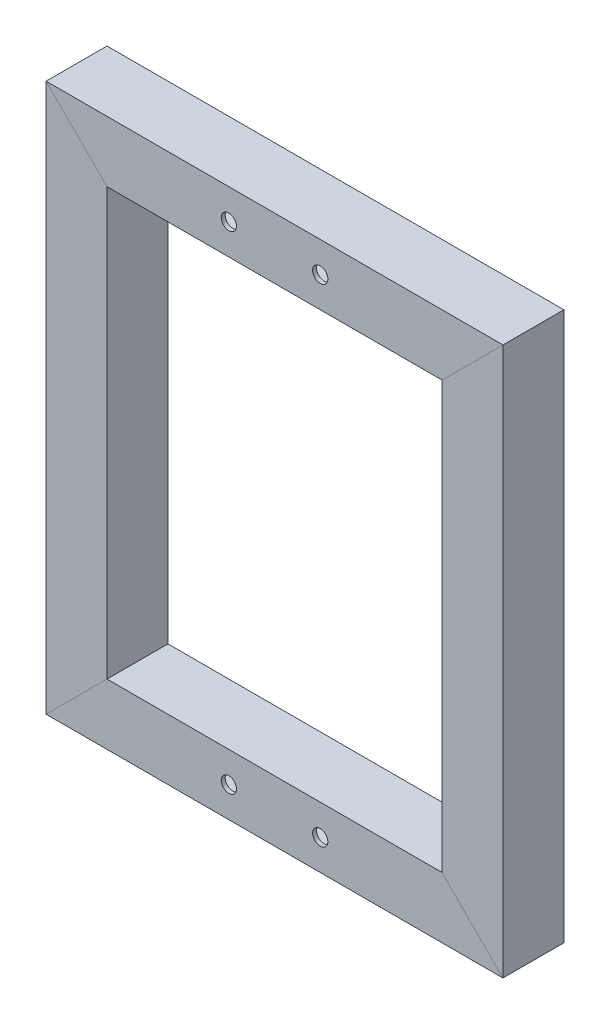
from build123d import *

# Parameters (mm, degrees)
STRUCTURAL_MEMBER1_DEPTH      = 227.421024484
STRUCTURAL_MEMBER1_DEPTH_BACK = 36.921024484
SKETCH11_W                    = 25.4
SKETCH11_H                    = 25.4
SKETCH11_W_2                  = 22.098
SKETCH11_H_2                  = 22.098
SKETCH11_ON_SEGMENT_2_W       = 25.4
SKETCH11_ON_SEGMENT_2_H       = 25.4
SKETCH11_ON_SEGMENT_2_W_2     = 22.098
SKETCH11_ON_SEGMENT_2_H_2     = 22.098
STRUCTURAL_MEMBER1_2_DEPTH    = 302.442048969
SKETCH11_ON_SEGMENT_3_W       = 25.4
SKETCH11_ON_SEGMENT_3_H       = 25.4
SKETCH11_ON_SEGMENT_3_W_2     = 22.098
SKETCH11_ON_SEGMENT_3_H_2     = 22.098
STRUCTURAL_MEMBER1_3_DEPTH    = 264.342048969
SKETCH11_ON_SEGMENT_4_W       = 25.4
SKETCH11_ON_SEGMENT_4_H       = 25.4
SKETCH11_ON_SEGMENT_4_W_2     = 22.098
SKETCH11_ON_SEGMENT_4_H_2     = 22.098
STRUCTURAL_MEMBER1_4_DEPTH    = 302.442048969
SKETCH13_R                    = 3.175
CUT_EXTRUDE1_DEPTH            = 262.797779946
SKETCH14_R                    = 3.175
CUT_EXTRUDE2_DEPTH            = 262.797779946


with BuildPart() as part:
    # Sketch11 → Structural Member1 (new, two sides: drawn at the far end of the back side and taken through both)
    with BuildSketch(Plane(origin=(-217.090748408, 131.399009505, 12.7), x_dir=(0, 1, 0), z_dir=(1, 0, 0)).offset(-STRUCTURAL_MEMBER1_DEPTH_BACK)):
        Rectangle(SKETCH11_W, SKETCH11_H)
        Rectangle(SKETCH11_W_2, SKETCH11_H_2, mode=Mode.SUBTRACT)
    extrude(amount=STRUCTURAL_MEMBER1_DEPTH + STRUCTURAL_MEMBER1_DEPTH_BACK)

    # Structural Member1 mitre 1
    split(bisect_by=Plane(origin=(-217.090748408, 144.099009505, 0), x_dir=(-0.707106781, 0.707106781, 0), z_dir=(0.707106781, 0.707106781, 0)), keep=Keep.TOP)

    # Structural Member1 mitre 2
    split(bisect_by=Plane(origin=(-26.590748408, 144.099009505, 0), x_dir=(-0.707106781, -0.707106781, 0), z_dir=(-0.707106781, 0.707106781, 0)), keep=Keep.TOP)

    # Sketch13 → Cut-Extrude1 (cut, through all)
    with BuildSketch(Plane(origin=(0, 0, 0), x_dir=(-1, 0, 0), z_dir=(0, 0, -1))):
        with Locations(Location((102.790748408, 131.399009505, 0), (0, 0, 90))):
            Circle(SKETCH13_R)
        with Locations(Location((140.890748408, 131.399009505, 0), (0, 0, 90))):
            Circle(SKETCH13_R)
    extrude(amount=-CUT_EXTRUDE1_DEPTH, mode=Mode.SUBTRACT)


with BuildPart() as body_2:
    # Sketch11 on segment 2 (carried to segment 2) → Structural Member1 2 (new body)
    with BuildSketch(Plane(origin=(-39.290748408, 181.020033989, 12.7), x_dir=(1, 0, 0), z_dir=(0, -1, 0))):
        Rectangle(SKETCH11_ON_SEGMENT_2_W, SKETCH11_ON_SEGMENT_2_H)
        Rectangle(SKETCH11_ON_SEGMENT_2_W_2, SKETCH11_ON_SEGMENT_2_H_2, mode=Mode.SUBTRACT)
    extrude(amount=STRUCTURAL_MEMBER1_2_DEPTH)

    # Structural Member1 2 mitre 1
    split(bisect_by=Plane(origin=(-26.590748408, 144.099009505, 0), x_dir=(0.707106781, 0.707106781, 0), z_dir=(0.707106781, -0.707106781, 0)), keep=Keep.TOP)

    # Structural Member1 2 mitre 2
    split(bisect_by=Plane(origin=(-26.590748408, -84.500990495, 0), x_dir=(-0.707106781, 0.707106781, 0), z_dir=(0.707106781, 0.707106781, 0)), keep=Keep.TOP)


with BuildPart() as body_3:
    # Sketch11 on segment 3 (carried to segment 3) → Structural Member1 3 (new body)
    with BuildSketch(Plane(origin=(10.330276076, -71.800990495, 12.7), x_dir=(0, -1, 0), z_dir=(-1, 0, 0))):
        Rectangle(SKETCH11_ON_SEGMENT_3_W, SKETCH11_ON_SEGMENT_3_H)
        Rectangle(SKETCH11_ON_SEGMENT_3_W_2, SKETCH11_ON_SEGMENT_3_H_2, mode=Mode.SUBTRACT)
    extrude(amount=STRUCTURAL_MEMBER1_3_DEPTH)

    # Structural Member1 3 mitre 1
    split(bisect_by=Plane(origin=(-217.090748408, -84.500990495, 0), x_dir=(0.707106781, 0.707106781, 0), z_dir=(0.707106781, -0.707106781, 0)), keep=Keep.TOP)

    # Structural Member1 3 mitre 2
    split(bisect_by=Plane(origin=(-26.590748408, -84.500990495, 0), x_dir=(0.707106781, -0.707106781, 0), z_dir=(-0.707106781, -0.707106781, 0)), keep=Keep.TOP)

    # Sketch14 → Cut-Extrude2 (cut, through all)
    with BuildSketch(Plane(origin=(0, 0, 0), x_dir=(-1, 0, 0), z_dir=(0, 0, -1))):
        with Locations(Location((140.890748408, -71.800990495, 0), (0, 0, 180))):
            Circle(SKETCH14_R)
        with Locations(Location((102.790748408, -71.800990495, 0), (0, 0, 90))):
            Circle(SKETCH14_R)
    extrude(amount=-CUT_EXTRUDE2_DEPTH, mode=Mode.SUBTRACT)


with BuildPart() as body_4:
    # Sketch11 on segment 4 (carried to segment 4) → Structural Member1 4 (new body)
    with BuildSketch(Plane(origin=(-204.390748408, -121.422014979, 12.7), x_dir=(-1, 0, 0), z_dir=(0, 1, 0))):
        Rectangle(SKETCH11_ON_SEGMENT_4_W, SKETCH11_ON_SEGMENT_4_H)
        Rectangle(SKETCH11_ON_SEGMENT_4_W_2, SKETCH11_ON_SEGMENT_4_H_2, mode=Mode.SUBTRACT)
    extrude(amount=STRUCTURAL_MEMBER1_4_DEPTH)

    # Structural Member1 4 mitre 1
    split(bisect_by=Plane(origin=(-217.090748408, 144.099009505, 0), x_dir=(0.707106781, -0.707106781, 0), z_dir=(-0.707106781, -0.707106781, 0)), keep=Keep.TOP)

    # Structural Member1 4 mitre 2
    split(bisect_by=Plane(origin=(-217.090748408, -84.500990495, 0), x_dir=(-0.707106781, -0.707106781, 0), z_dir=(-0.707106781, 0.707106781, 0)), keep=Keep.TOP)


solid = Compound([part.part, body_2.part, body_3.part, body_4.part])
